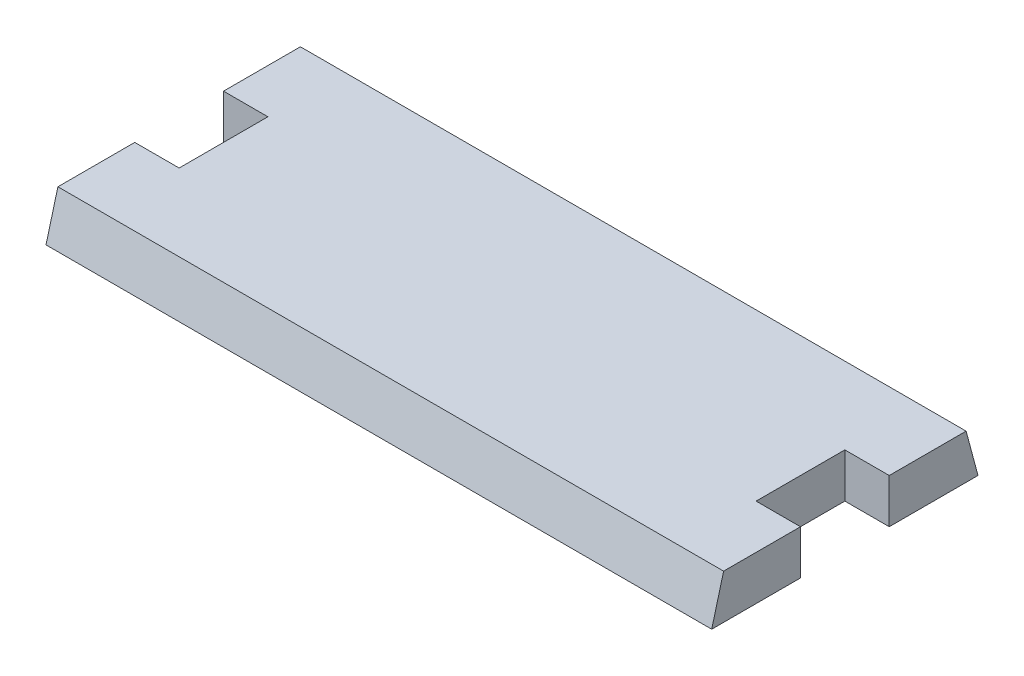
from build123d import *

# Parameters (mm, degrees)
BOSS_EXTRUDE1_DEPTH = 10
DRAFT21_ANGLE       = -15
DRAFT22_ANGLE       = -15


with BuildPart() as part:
    # Sketch1 → Boss-Extrude1 (new body)
    with BuildSketch(Plane(origin=(0, 0, 0), x_dir=(1, 0, 0), z_dir=(0, 1, 0))):
        Polygon((0, 0), (0, 20), (-10, 20), (-10, 40), (0, 40), (0, 60), (-150, 60), (-150, 40), (-140, 40), (-140, 20), (-150, 20), (-150, 0), align=None)
    extrude(amount=BOSS_EXTRUDE1_DEPTH)

    # Draft21
    draft21_faces = [part.faces().sort_by_distance(p)[0] for p in [
        (-75, 5, 0),
    ]]
    draft(draft21_faces, Plane(origin=(0, 0, 0), x_dir=(0, 0, -1), z_dir=(0, -1, 0)), DRAFT21_ANGLE)

    # Draft22
    draft22_faces = [part.faces().sort_by_distance(p)[0] for p in [
        (-75, 5, -60),
    ]]
    draft(draft22_faces, Plane(origin=(0, 0, 0), x_dir=(0, 0, -1), z_dir=(0, -1, 0)), DRAFT22_ANGLE)


solid = part.part
